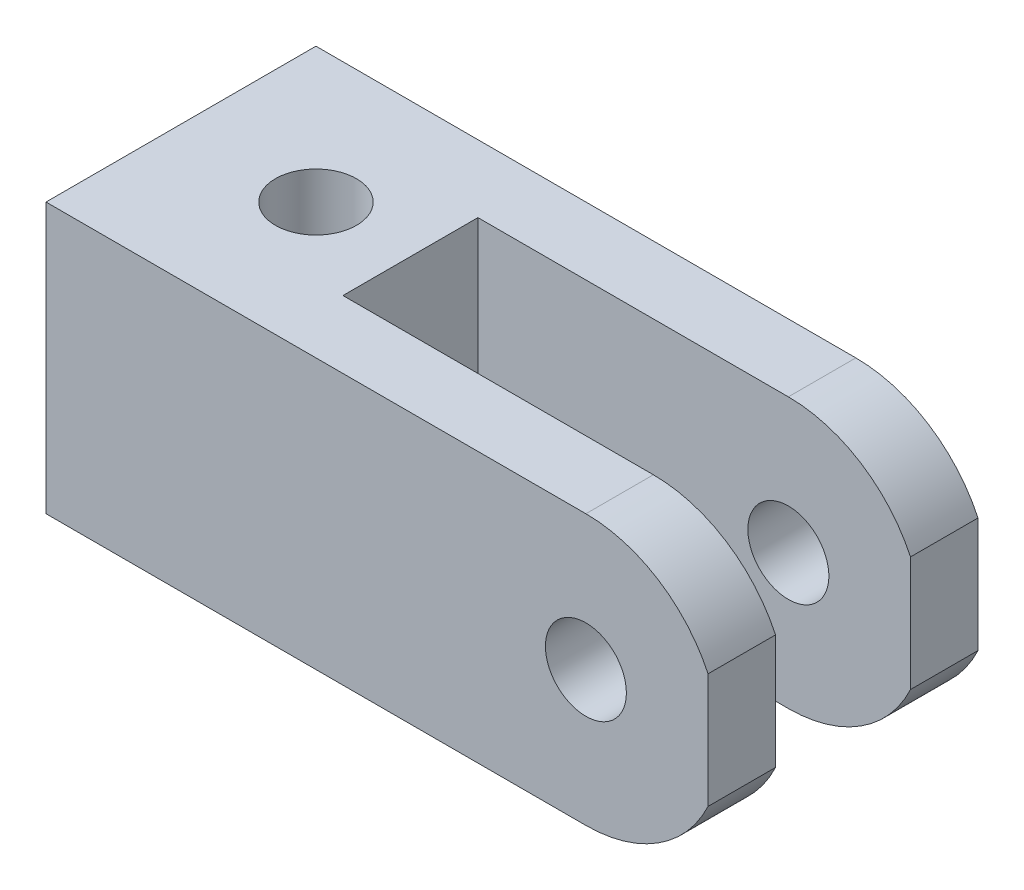
from build123d import *

# Parameters (mm, degrees)
CROQUIS1_W              = 25
CROQUIS1_H              = 10
CROQUIS1_R              = 1.5
SALIENTE_EXTRUIR1_DEPTH = 10
CROQUIS2_R              = 1.5
CORTAR_EXTRUIR1_DEPTH   = 14
CROQUIS3_W              = 5
CROQUIS3_H              = 10
CORTAR_EXTRUIR2_DEPTH   = 16.5
CUT_EXTRUDE1_DEPTH      = 10


with BuildPart() as part:
    # Croquis1 → Saliente-Extruir1 (new body)
    with BuildSketch(Plane.XY):
        with Locations((-7.5, 0)):
            Rectangle(CROQUIS1_W, CROQUIS1_H)
        Circle(CROQUIS1_R, mode=Mode.SUBTRACT)
    extrude(amount=SALIENTE_EXTRUIR1_DEPTH)

    # Croquis2 → Cortar-Extruir1 (cut)
    with BuildSketch(Plane(origin=(0, 5, 0), x_dir=(1, 0, 0), z_dir=(0, 1, 0))):
        with Locations(Location((-15, -5, 0), (0, 0, 180))):
            Circle(CROQUIS2_R)
    extrude(amount=-CORTAR_EXTRUIR1_DEPTH, mode=Mode.SUBTRACT)

    # Croquis3 → Cortar-Extruir2 (cut)
    with BuildSketch(Plane(origin=(5, 0, 0), x_dir=(0, 0, -1), z_dir=(1, 0, 0))):
        with Locations((-5, 0)):
            Rectangle(CROQUIS3_W, CROQUIS3_H)
    extrude(amount=-CORTAR_EXTRUIR2_DEPTH, mode=Mode.SUBTRACT)

    # Sketch1 → Cut-Extrude1 (cut)
    with BuildSketch(Plane.XY.offset(10)):
        with BuildLine():
            Line((0, 5), (5.992915048, 5))
            Line((5.992915048, 5), (5.992915048, -6.748814934))
            Line((5.992915048, -6.748814934), (0, -5))
            ThreePointArc((0, -5), (2.680080756, -4.221038633), (4.525089765, -2.126866856))
            Line((4.525089765, -2.126866856), (4.525089765, 2.126866856))
            ThreePointArc((4.525089765, 2.126866856), (2.680080756, 4.221038633), (0, 5))
        make_face()
    extrude(amount=-CUT_EXTRUDE1_DEPTH, mode=Mode.SUBTRACT)


solid = part.part
